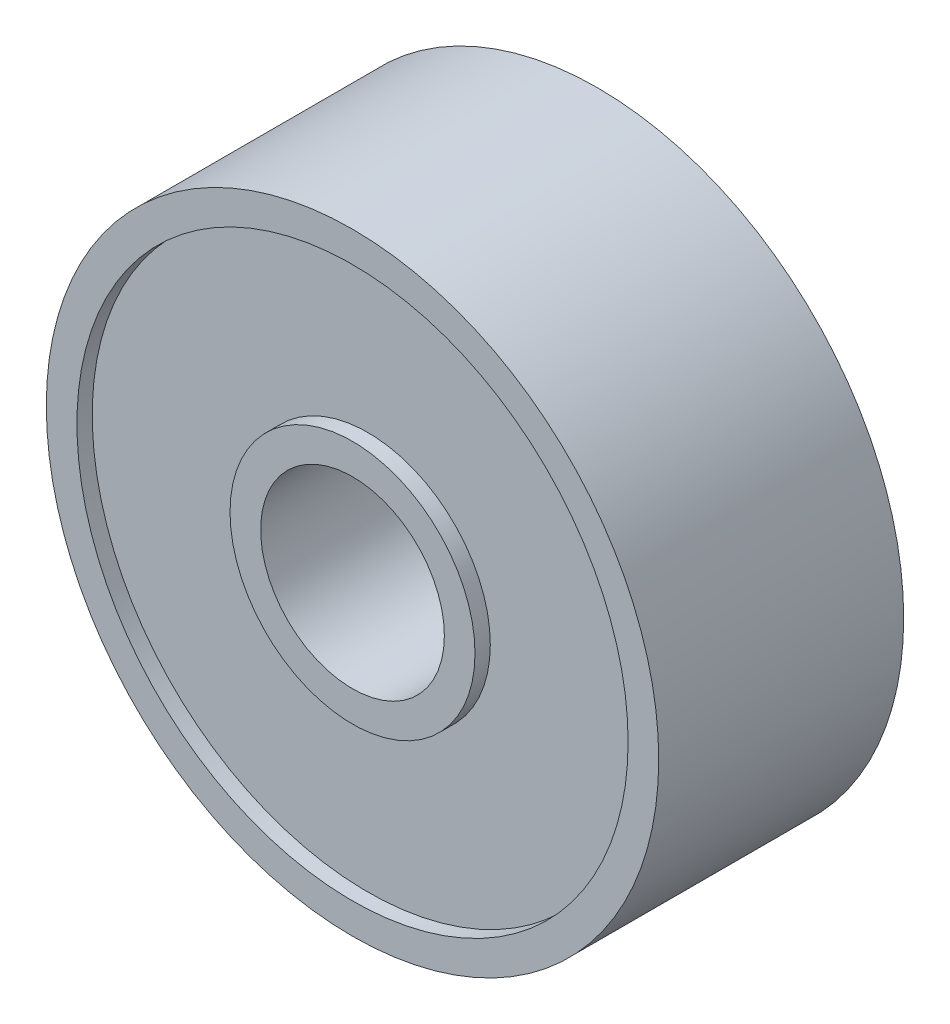
from build123d import *

# Parameters (mm, degrees)
SKETCH1_R           = 5
SKETCH1_R_2         = 1.5
BOSS_EXTRUDE1_DEPTH = 2
SKETCH2_R           = 4.5
SKETCH2_R_2         = 2
CUT_EXTRUDE1_DEPTH  = 0.25


with BuildPart() as part:
    # Sketch1 → Boss-Extrude1 (new, symmetric)
    with BuildSketch(Plane.XY):
        Circle(SKETCH1_R)
        Circle(SKETCH1_R_2, mode=Mode.SUBTRACT)
    extrude(amount=BOSS_EXTRUDE1_DEPTH, both=True)

    # Sketch2 → Cut-Extrude1 (cut)
    with BuildSketch(Plane.XY.offset(2)):
        Circle(SKETCH2_R)
        Circle(SKETCH2_R_2, mode=Mode.SUBTRACT)
    cut_extrude1 = extrude(amount=-CUT_EXTRUDE1_DEPTH, mode=Mode.SUBTRACT)

    # Mirror1: Cut-Extrude1 across plane
    add(cut_extrude1.mirror(Plane.XY), mode=Mode.SUBTRACT)


solid = part.part
